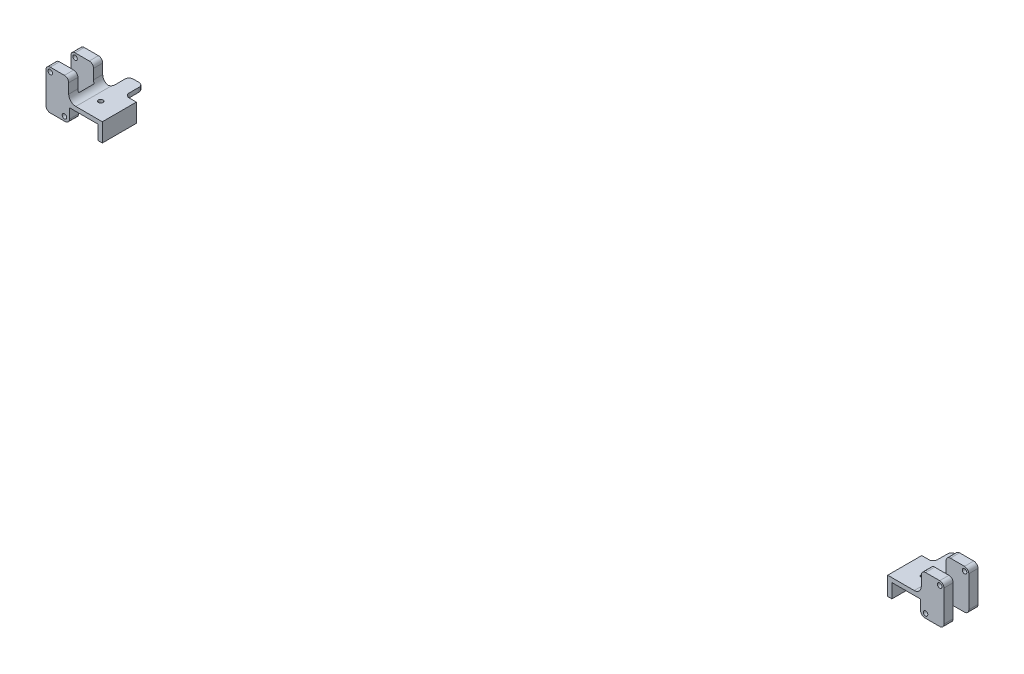
from build123d import *

# Parameters (mm, degrees)
SKETCH_1_R          = 1.6
EXTRUDE_1_DEPTH     = 12
SKETCH_2_W          = 16.5
SKETCH_2_H          = 11
CUT_EXTRUDE_1_DEPTH = 41.442057317
SKETCH_3_W          = 10
SKETCH_3_H          = 13
EXTRUDE_2_DEPTH     = 3
SKETCH_4_R          = 1.6
CUT_EXTRUDE_2_DEPTH = 40.465934678
FILLET_1_R          = 3
FILLET_2_R          = 5


with BuildPart() as part:
    # 草图1 → 凸台-拉伸1 (new, symmetric)
    with BuildSketch(Plane.XY):
        Polygon((-10.1, 0), (-10.1, 10), (10.1, 10), (10.1, 0), (13.1, 0), (26.6, 0), (26.6, 28), (10.6, 28), (10.6, 13), (-13.1, 13), (-13.1, 0), align=None)
        with Locations((23.6, 25)):
            Circle(SKETCH_1_R, mode=Mode.SUBTRACT)
        with Locations((13.6, 3)):
            Circle(SKETCH_1_R, mode=Mode.SUBTRACT)
    extrude(amount=EXTRUDE_1_DEPTH, both=True)

    # 草图2 → 切除-拉伸1 (cut, through all)
    with BuildSketch(Plane.XZ):
        with Locations((18.35, 0)):
            Rectangle(SKETCH_2_W, SKETCH_2_H)
    extrude(amount=-CUT_EXTRUDE_1_DEPTH, mode=Mode.SUBTRACT)

    # 草图3 → 凸台-拉伸2 (add)
    with BuildSketch(Plane(origin=(0, 13, 0), x_dir=(1, 0, 0), z_dir=(0, 1, 0))):
        with Locations((0, 18.5)):
            Rectangle(SKETCH_3_W, SKETCH_3_H)
    extrude(amount=-EXTRUDE_2_DEPTH)

    # 草图4 → 切除-拉伸2 (cut, through all)
    with BuildSketch(Plane(origin=(0, 13, 0), x_dir=(1, 0, 0), z_dir=(0, 1, 0))):
        with Locations(Location((0, 0, 0), (0, 0, 180))):
            Circle(SKETCH_4_R)
    extrude(amount=-CUT_EXTRUDE_2_DEPTH, mode=Mode.SUBTRACT)

    # 圆角1
    fillet_1_edges = [part.edges().sort_by_distance(p)[0] for p in [
        (10.6, 28, 8.75),
        (26.6, 28, 8.75),
        (26.6, 0, 8.75),
        (10.1, 0, 8.75),
        (10.6, 28, -8.75),
        (26.6, 28, -8.75),
        (26.6, 0, -8.75),
        (10.1, 0, -8.75),
        (5, 11.5, -25),
        (5, 11.5, -12),
        (-5, 11.5, -12),
        (-5, 11.5, -25),
    ]]
    fillet(fillet_1_edges, radius=FILLET_1_R)

    # 圆角2
    fillet_2_edges = [part.edges().sort_by_distance(p)[0] for p in [
        (10.6, 13, -8.75),
    ]]
    fillet(fillet_2_edges, radius=FILLET_2_R)


with BuildPart() as body_2:
    # 镜向1: mirrored copy
    add(part.part.mirror(Plane(origin=(-290, 0, 0), x_dir=(0, 0, 1), z_dir=(1, 0, 0))))


solid = Compound([part.part, body_2.part])
